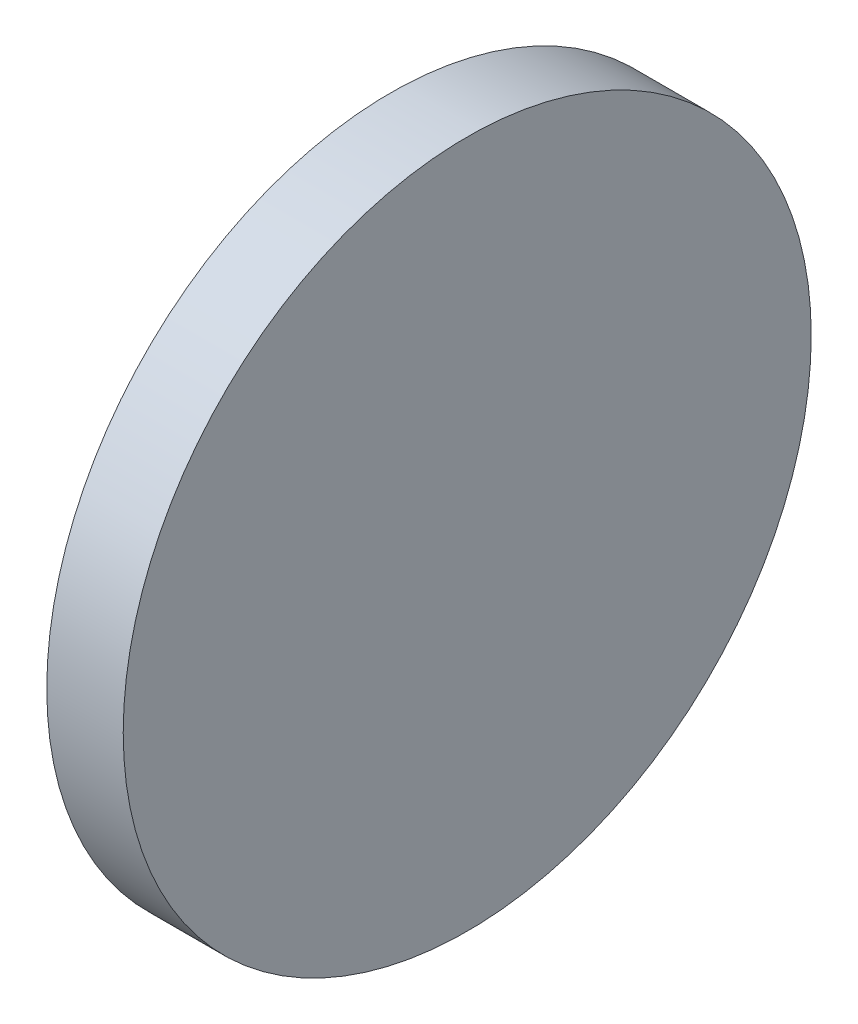
from build123d import *

# Parameters (mm, degrees)
SKETCH1_R           = 22.5
BOSS_EXTRUDE1_DEPTH = 5


with BuildPart() as part:
    # Sketch1 → Boss-Extrude1 (new body)
    with BuildSketch(Plane(origin=(0, 0, 0), x_dir=(0, 0, -1), z_dir=(1, 0, 0))):
        Circle(SKETCH1_R)
    extrude(amount=BOSS_EXTRUDE1_DEPTH)


solid = part.part
